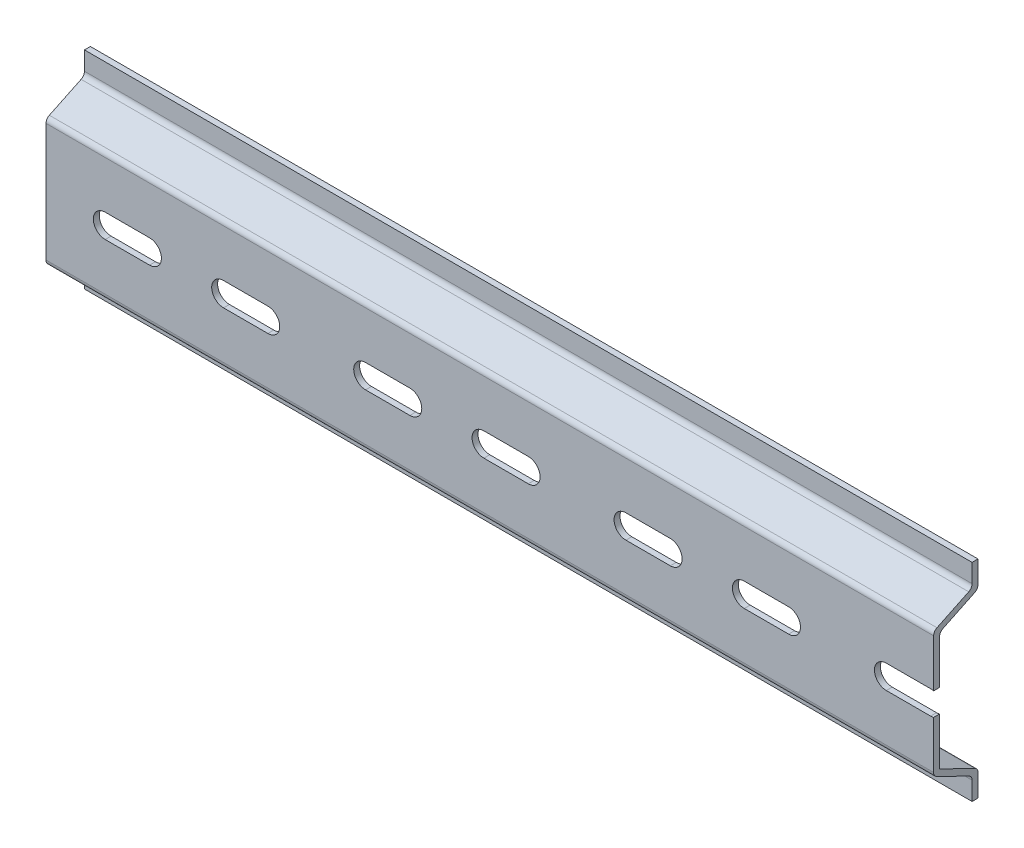
from build123d import *

# Parameters (mm, degrees)
EXTRUDE_1_DEPTH     = 150
FILLET_1_R          = 1
CUT_EXTRUDE_1_DEPTH = 10


with BuildPart() as part:
    # 草图1 → 凸台-拉伸1 (new body)
    with BuildSketch(Plane(origin=(0, 0, 0), x_dir=(0, 0, -1), z_dir=(1, 0, 0))):
        Polygon((0, -10), (0, 10), (6.5, 13.120839269), (6.5, 17.5), (5.5, 17.5), (5.5, 13.75), (-1, 10.629160731), (-1, -10.629160731), (5.5, -13.75), (5.5, -17.5), (6.5, -17.5), (6.5, -13.120839269), align=None)
    extrude(amount=EXTRUDE_1_DEPTH)

    # 圆角1
    fillet_1_edges = [part.edges().sort_by_distance(p)[0] for p in [
        (75, 10, 0),
        (75, -13.120839269, -6.5),
        (75, -13.75, -5.5),
        (75, -10.629160731, 1),
        (75, 10.629160731, 1),
        (75, 13.75, -5.5),
        (75, 13.120839269, -6.5),
    ]]
    fillet(fillet_1_edges, radius=FILLET_1_R)

    # 草图2 → 切除-拉伸1 (cut)
    with BuildSketch(Plane(origin=(0, 0, 0), x_dir=(-1, 0, 0), z_dir=(0, 0, -1))):
        with BuildLine():
            Line((-10, -2), (-17.5, -2))
            ThreePointArc((-17.5, -2), (-19.5, 0), (-17.5, 2))
            Line((-17.5, 2), (-10, 2))
            ThreePointArc((-10, 2), (-8, 0), (-10, -2))
        make_face()
        with BuildLine():
            Line((-30, -2), (-37.5, -2))
            ThreePointArc((-37.5, -2), (-39.5, 0), (-37.5, 2))
            Line((-37.5, 2), (-30, 2))
            ThreePointArc((-30, 2), (-28, 0), (-30, -2))
        make_face()
        with BuildLine():
            Line((-54, -2), (-61.5, -2))
            ThreePointArc((-61.5, -2), (-63.5, 0), (-61.5, 2))
            Line((-61.5, 2), (-54, 2))
            ThreePointArc((-54, 2), (-52, 0), (-54, -2))
        make_face()
        with BuildLine():
            Line((-74, -2), (-81.5, -2))
            ThreePointArc((-81.5, -2), (-83.5, 0), (-81.5, 2))
            Line((-81.5, 2), (-74, 2))
            ThreePointArc((-74, 2), (-72, 0), (-74, -2))
        make_face()
        with BuildLine():
            Line((-98, -2), (-105.5, -2))
            ThreePointArc((-105.5, -2), (-107.5, 0), (-105.5, 2))
            Line((-105.5, 2), (-98, 2))
            ThreePointArc((-98, 2), (-96, 0), (-98, -2))
        make_face()
        with BuildLine():
            Line((-118, -2), (-125.5, -2))
            ThreePointArc((-125.5, -2), (-127.5, 0), (-125.5, 2))
            Line((-125.5, 2), (-118, 2))
            ThreePointArc((-118, 2), (-116, 0), (-118, -2))
        make_face()
        with BuildLine():
            Line((-142, -2), (-149.5, -2))
            ThreePointArc((-149.5, -2), (-151.5, 0), (-149.5, 2))
            Line((-149.5, 2), (-142, 2))
            ThreePointArc((-142, 2), (-140, 0), (-142, -2))
        make_face()
        with BuildLine():
            Line((-162, -2), (-169.5, -2))
            ThreePointArc((-169.5, -2), (-171.5, 0), (-169.5, 2))
            Line((-169.5, 2), (-162, 2))
            ThreePointArc((-162, 2), (-160, 0), (-162, -2))
        make_face()
        with BuildLine():
            Line((-186, -2), (-193.5, -2))
            ThreePointArc((-193.5, -2), (-195.5, 0), (-193.5, 2))
            Line((-193.5, 2), (-186, 2))
            ThreePointArc((-186, 2), (-184, 0), (-186, -2))
        make_face()
        with BuildLine():
            Line((-206, -2), (-213.5, -2))
            ThreePointArc((-213.5, -2), (-215.5, 0), (-213.5, 2))
            Line((-213.5, 2), (-206, 2))
            ThreePointArc((-206, 2), (-204, 0), (-206, -2))
        make_face()
        with BuildLine():
            Line((-230, -2), (-237.5, -2))
            ThreePointArc((-237.5, -2), (-239.5, 0), (-237.5, 2))
            Line((-237.5, 2), (-230, 2))
            ThreePointArc((-230, 2), (-228, 0), (-230, -2))
        make_face()
        with BuildLine():
            Line((-250, -2), (-257.5, -2))
            ThreePointArc((-257.5, -2), (-259.5, 0), (-257.5, 2))
            Line((-257.5, 2), (-250, 2))
            ThreePointArc((-250, 2), (-248, 0), (-250, -2))
        make_face()
        with BuildLine():
            Line((-274, -2), (-281.5, -2))
            ThreePointArc((-281.5, -2), (-283.5, 0), (-281.5, 2))
            Line((-281.5, 2), (-274, 2))
            ThreePointArc((-274, 2), (-272, 0), (-274, -2))
        make_face()
        with BuildLine():
            Line((-294, -2), (-301.5, -2))
            ThreePointArc((-301.5, -2), (-303.5, 0), (-301.5, 2))
            Line((-301.5, 2), (-294, 2))
            ThreePointArc((-294, 2), (-292, 0), (-294, -2))
        make_face()
        with BuildLine():
            Line((-318, -2), (-325.5, -2))
            ThreePointArc((-325.5, -2), (-327.5, 0), (-325.5, 2))
            Line((-325.5, 2), (-318, 2))
            ThreePointArc((-318, 2), (-316, 0), (-318, -2))
        make_face()
        with BuildLine():
            Line((-338, -2), (-345.5, -2))
            ThreePointArc((-345.5, -2), (-347.5, 0), (-345.5, 2))
            Line((-345.5, 2), (-338, 2))
            ThreePointArc((-338, 2), (-336, 0), (-338, -2))
        make_face()
        with BuildLine():
            Line((-362, -2), (-369.5, -2))
            ThreePointArc((-369.5, -2), (-371.5, 0), (-369.5, 2))
            Line((-369.5, 2), (-362, 2))
            ThreePointArc((-362, 2), (-360, 0), (-362, -2))
        make_face()
        with BuildLine():
            Line((-382, -2), (-389.5, -2))
            ThreePointArc((-389.5, -2), (-391.5, 0), (-389.5, 2))
            Line((-389.5, 2), (-382, 2))
            ThreePointArc((-382, 2), (-380, 0), (-382, -2))
        make_face()
    extrude(amount=-CUT_EXTRUDE_1_DEPTH, mode=Mode.SUBTRACT)


solid = part.part
